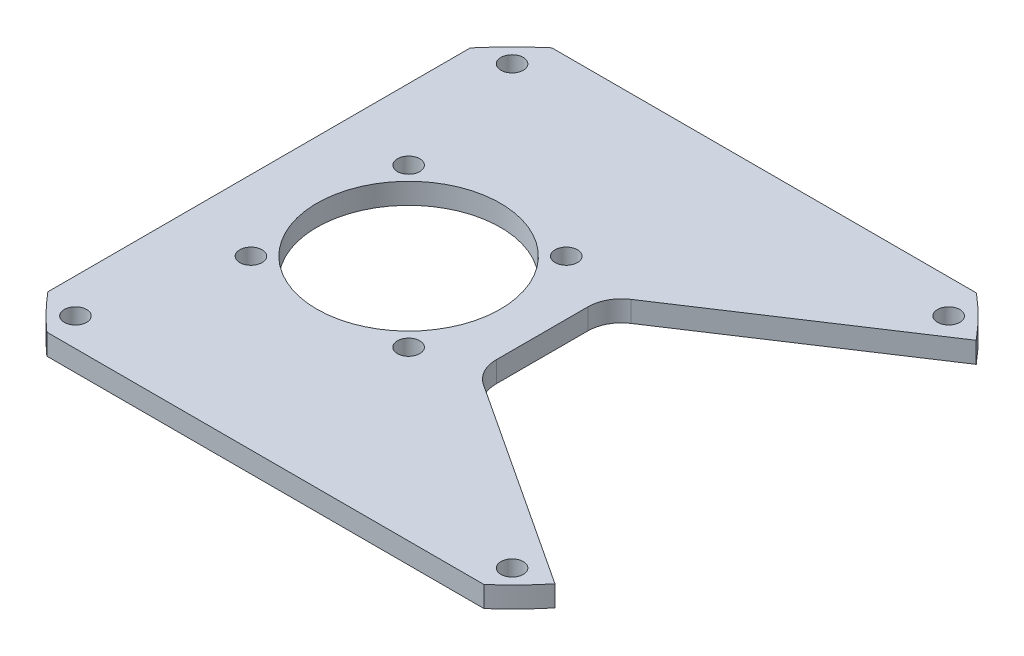
from build123d import *

# Parameters (mm, degrees)
SKETCH1_R            = 13.97
BOSS_EXTRUDE1_DEPTH  = 1.5875
FILLET1_R            = 5.08
M3_CLEARANCE_HOLE1_D = 3.4
M3_CLEARANCE_HOLE2_D = 3.4


with BuildPart() as part:
    # Sketch1 → Boss-Extrude1 (new, symmetric)
    with BuildSketch(Plane(origin=(0, 0, 0), x_dir=(1, 0, 0), z_dir=(0, 1, 0))):
        with BuildLine():
            Line((-38.50947489, 32.14883464), (-38.50947489, -32.14883464))
            ThreePointArc((-38.50947489, -32.14883464), (-35.992876625, -34.943383598), (-33.274, -37.541552299))
            Line((-33.274, -37.541552299), (33.274, -37.541552299))
            ThreePointArc((33.274, -37.541552299), (36.035191498, -34.899744966), (38.587271968, -32.055415565))
            Line((38.587271968, -32.055415565), (4.572, -9.720985565))
            Line((4.572, -9.720985565), (4.572, 9.720985565))
            Line((4.572, 9.720985565), (38.541369471, 32.110591154))
            ThreePointArc((38.541369471, 32.110591154), (35.567819018, 35.375944868), (32.318597457, 38.367114609))
            Line((32.318597457, 38.367114609), (-32.318597457, 38.367114609))
            ThreePointArc((-32.318597457, 38.367114609), (-35.55025611, 35.393594272), (-38.50947489, 32.14883464))
        make_face()
        with Locations(Location((-15.748, 0, 0), (0, 0, 270))):
            Circle(SKETCH1_R, mode=Mode.SUBTRACT)
    extrude(amount=BOSS_EXTRUDE1_DEPTH, both=True)

    # Fillet1
    fillet1_edges = [part.edges().sort_by_distance(p)[0] for p in [
        (4.572, 0, -9.720985565),
        (4.572, 0, 9.720985565),
    ]]
    fillet(fillet1_edges, radius=FILLET1_R)

    # M3 Clearance Hole1 (through all)
    with Locations(Plane(origin=(0, 1.5875, 0), x_dir=(1, 0, 0), z_dir=(0, 1, 0))):
        with Locations((-33.226947648, 33.226947648), (33.226947648, 33.226947648), (33.226947648, -33.226947648), (-33.226947648, -33.226947648)):
            Hole(M3_CLEARANCE_HOLE1_D / 2)

    # M3 Clearance Hole2 (through all)
    with Locations(Plane(origin=(0, 1.5875, 0), x_dir=(1, 0, 0), z_dir=(0, 1, 0))):
        with Locations((-27.748, 12), (-3.748, 12), (-3.748, -12), (-27.748, -12)):
            Hole(M3_CLEARANCE_HOLE2_D / 2)


solid = part.part
